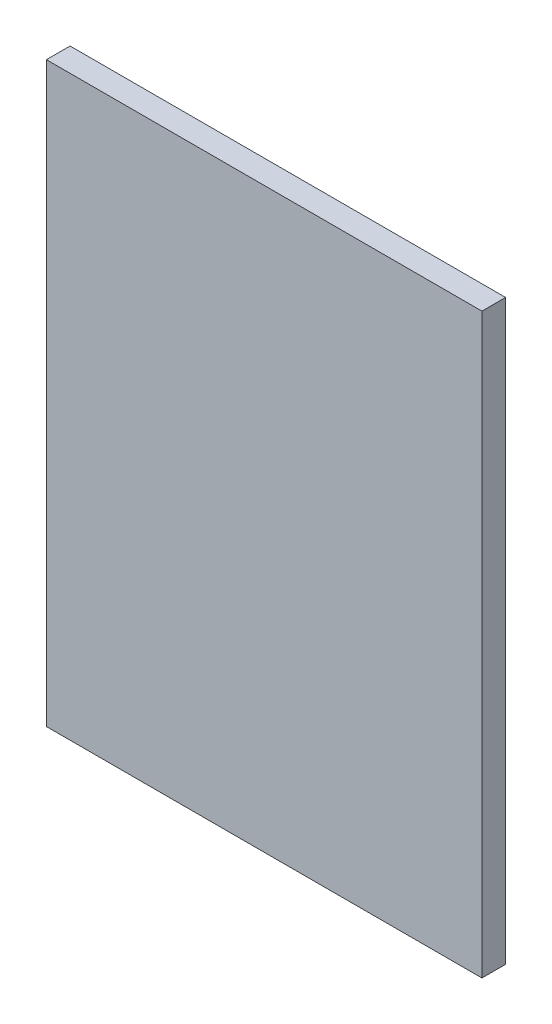
from build123d import *

# Parameters (mm, degrees)
SKETCH1_W           = 460
SKETCH1_H           = 610
BOSS_EXTRUDE1_DEPTH = 25
BOSS_EXTRUDE2_START = -50
SKETCH2_R           = 37.5
BOSS_EXTRUDE2_DEPTH = 100
SKETCH3_R           = 10
BOSS_EXTRUDE3_DEPTH = 100
BOSS_EXTRUDE4_START = -50
SKETCH4_R           = 22.139424637
BOSS_EXTRUDE4_DEPTH = 30
BOSS_EXTRUDE5_START = -200
SKETCH5_W           = 75
SKETCH5_H           = 75
SKETCH5_R           = 15
BOSS_EXTRUDE5_DEPTH = 50
FILLET1_R           = 20


with BuildPart() as part:
    # Sketch1 → Boss-Extrude1 (new body)
    with BuildSketch(Plane.XY):
        with Locations((241.863857374, -305)):
            Rectangle(SKETCH1_W, SKETCH1_H)
    extrude(amount=BOSS_EXTRUDE1_DEPTH)

    # Sketch5 → Boss-Extrude5 (add)
    with BuildSketch(Plane.ZY.offset(-11.863857374).offset(BOSS_EXTRUDE5_START)):
        with Locations((-37.5, -137.5)):
            Rectangle(SKETCH5_W, SKETCH5_H)
        with Locations((-37.5, -137.5)):
            Circle(SKETCH5_R, mode=Mode.SUBTRACT)
    extrude(amount=-BOSS_EXTRUDE5_DEPTH)

    # Fillet1
    fillet1_edges = [part.edges().sort_by_distance(p)[0] for p in [
        (236.863857374, -100, -75),
        (236.863857374, -175, -75),
    ]]
    fillet(fillet1_edges, radius=FILLET1_R)


with BuildPart() as body_2:
    # Sketch2 → Boss-Extrude2 (new body)
    with BuildSketch(Plane.ZY.offset(-11.863857374).offset(BOSS_EXTRUDE2_START)):
        with Locations((-37.5, -510)):
            Circle(SKETCH2_R)
    extrude(amount=-BOSS_EXTRUDE2_DEPTH)

    # Sketch3 → Boss-Extrude3 (add)
    with BuildSketch(Plane(origin=(161.863857374, 0, 0), x_dir=(0, 0, -1), z_dir=(1, 0, 0))):
        with Locations((37.5, -510)):
            Circle(SKETCH3_R)
    extrude(amount=BOSS_EXTRUDE3_DEPTH)

    # Sketch4 → Boss-Extrude4 (add)
    with BuildSketch(Plane(origin=(261.863857374, 0, 0), x_dir=(0, 0, -1), z_dir=(1, 0, 0)).offset(BOSS_EXTRUDE4_START)):
        with Locations((37.5, -510)):
            Circle(SKETCH4_R)
    extrude(amount=BOSS_EXTRUDE4_DEPTH)


solid = Compound([part.part, body_2.part])
